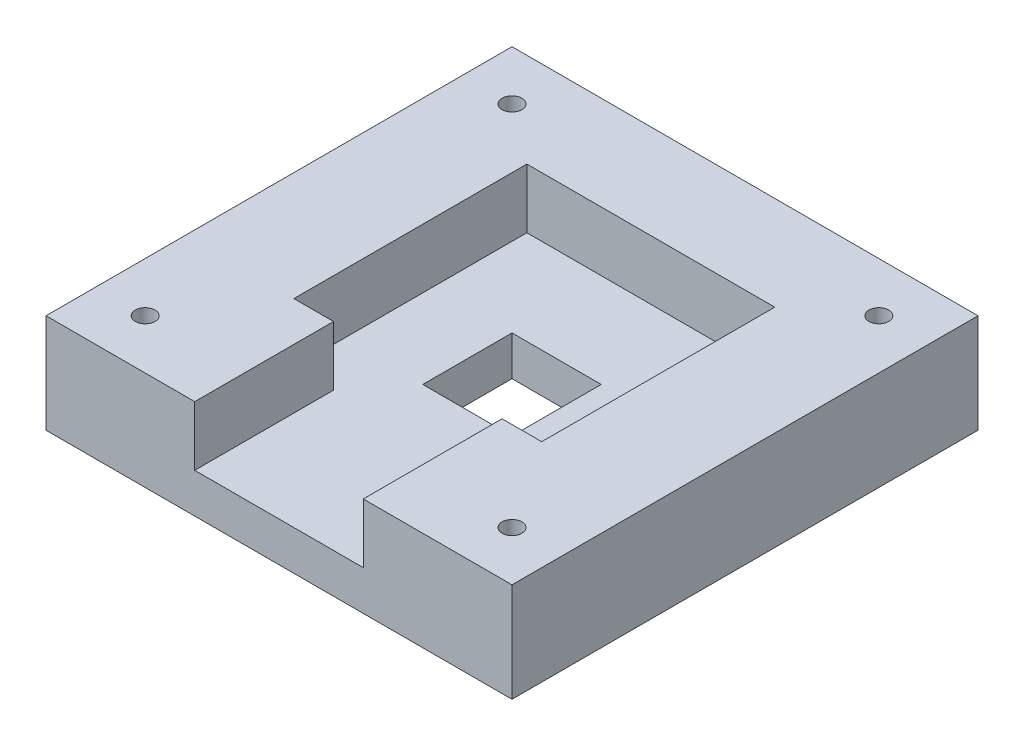
from build123d import *

# Parameters (mm, degrees)
SKETCH1_W           = 47
SKETCH1_H           = 47
BOSS_EXTRUDE1_DEPTH = 10
SKETCH2_W           = 9
SKETCH2_H           = 9
CUT_EXTRUDE1_DEPTH  = 4
CUT_EXTRUDE3_DEPTH  = 53.328290628
SKETCH8_R           = 1
CUT_EXTRUDE4_DEPTH  = 68.216069507


with BuildPart() as part:
    # Sketch1 → Boss-Extrude1 (new body)
    with BuildSketch(Plane(origin=(0, 0, 0), x_dir=(1, 0, 0), z_dir=(0, 1, 0))):
        with Locations((23.5, -23.5)):
            Rectangle(SKETCH1_W, SKETCH1_H)
    extrude(amount=BOSS_EXTRUDE1_DEPTH)

    # Sketch2 → Cut-Extrude1 (cut)
    with BuildSketch(Plane(origin=(0, 0, 0), x_dir=(-1, 0, 0), z_dir=(0, -1, 0))):
        with Locations((-23.5, -23.5)):
            Rectangle(SKETCH2_W, SKETCH2_H)
    extrude(amount=-CUT_EXTRUDE1_DEPTH, mode=Mode.SUBTRACT)

    # 3DSketch1 → Cut-Extrude3 (cut, through all)
    with BuildSketch(Plane(origin=(36, 4, 9.5), x_dir=(-0.4886033689318435, 0, 0.87250601594972), z_dir=(0, -1, 0))):
        Polygon((0, 0), (12.215084223, 21.812650399), (32.718975598, 10.330471229), (20.503891375, -11.48217917), align=None)
        Polygon((22.458304851, -7.992155106), (30.764562122, 6.840447165), (42.979646346, 0), (34.673389074, -14.832602271), align=None)
    extrude(amount=-CUT_EXTRUDE3_DEPTH, mode=Mode.SUBTRACT)

    # Sketch8 → Cut-Extrude4 (cut, through all)
    with BuildSketch(Plane.XZ):
        with Locations(Location((42, 5, 0), (0, 0, 270))):
            Circle(SKETCH8_R)
        with Locations(Location((5, 5, 0), (0, 0, 270))):
            Circle(SKETCH8_R)
        with Locations(Location((5, 42, 0), (0, 0, 270))):
            Circle(SKETCH8_R)
        with Locations(Location((42, 42, 0), (0, 0, 270))):
            Circle(SKETCH8_R)
    extrude(amount=-CUT_EXTRUDE4_DEPTH, mode=Mode.SUBTRACT)


solid = part.part
